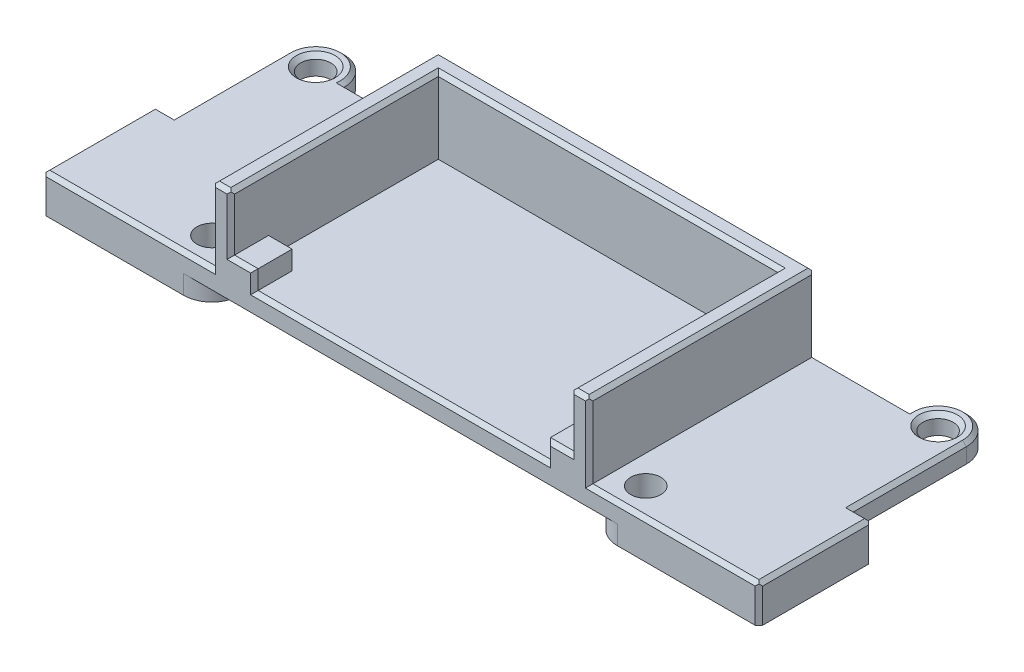
from build123d import *

# Parameters (mm, degrees)
SKETCH_1_W                   = 3
SKETCH_1_H                   = 1
SKETCH_1_H_2                 = 2
SKETCH_1_W_2                 = 30
EXTRUDE_1_DEPTH              = 1
SKETCH_2_W                   = 20
SKETCH_2_H                   = 12
SKETCH_2_W_2                 = 18
SKETCH_2_H_2                 = 10
EXTRUDE_4_DEPTH              = 4
SKETCH_8_W                   = 18
SKETCH_8_H                   = 4
CUT_EXTRUDE_2_DEPTH          = 4
SKETCH_9_W                   = 1.25
SKETCH_9_H                   = 1
EXTRUDE_5_DEPTH              = 2
EXTRUDE_6_DEPTH              = 1
HOLE_WIZARD_M2_1_D           = 1.6
HOLE_WIZARD_M2_1_DEPTH       = 5.5
HOLE_WIZARD_M2_1_CSINK_D     = 2.05
HOLE_WIZARD_M2_1_CSINK_ANGLE = 90
HOLE_WIZARD_M2_1_TIP         = 0.480688495
HOLE_WIZARD_M2_2_D           = 1.6
HOLE_WIZARD_M2_2_CSINK_D     = 2.05
HOLE_WIZARD_M2_2_CSINK_ANGLE = 90
CHAMFER_1_SIZE               = 0.2
CHAMFER_2_SIZE               = 0.2
CHAMFER_3_SIZE               = 0.2
CHAMFER_4_SIZE               = 0.2
CHAMFER_5_SIZE               = 0.2
SKETCH_16_R                  = 0.8
EXTRUDE_7_DEPTH              = 3
SKETCH_17_R                  = 0.8
CUT_EXTRUDE_3_DEPTH          = 22


with BuildPart() as part:
    # 草图1 → 凸台-拉伸1 (new body)
    with BuildSketch(Plane(origin=(0, 0, 0), x_dir=(1, 0, 0), z_dir=(0, 1, 0))):
        with BuildLine():
            ThreePointArc((-15, 4), (-16.5, 5.5), (-18, 4))
            Line((-18, 4), (-15, 4))
        make_face()
        with BuildLine():
            ThreePointArc((-15, 4), (-16.5, 2.5), (-18, 4))
            Line((-18, 4), (-18, -1))
            Line((-18, -1), (-15, -1))
            Line((-15, -1), (-15, -2))
            Line((-15, -2), (15, -2))
            Line((15, -2), (15, -1))
            Line((15, -1), (18, -1))
            Line((18, -1), (18, 4))
            ThreePointArc((18, 4), (16.5, 2.5), (15, 4))
            Line((15, 4), (-15, 4))
        make_face()
        with BuildLine():
            Line((-15, 4), (-18, 4))
            ThreePointArc((-18, 4), (-16.5, 2.5), (-15, 4))
        make_face()
        with Locations((-16.5, -1.5)):
            Rectangle(SKETCH_1_W, SKETCH_1_H)
        with BuildLine():
            ThreePointArc((18, 4), (16.5, 5.5), (15, 4))
            Line((15, 4), (18, 4))
        make_face()
        with BuildLine():
            Line((18, 4), (15, 4))
            ThreePointArc((15, 4), (16.5, 2.5), (18, 4))
        make_face()
        with Locations((-16.5, -3)):
            Rectangle(SKETCH_1_W, SKETCH_1_H_2)
        Polygon((-18, -4), (-18, -2), (-19, -2), (-19, -8), (19, -8), (19, -2), (18, -2), (18, -4), (15, -4), (-15, -4), align=None)
        with Locations((0, -3)):
            Rectangle(SKETCH_1_W_2, SKETCH_1_H_2)
        with Locations((16.5, -1.5)):
            Rectangle(SKETCH_1_W, SKETCH_1_H)
        with Locations((16.5, -3)):
            Rectangle(SKETCH_1_W, SKETCH_1_H_2)
    extrude(amount=EXTRUDE_1_DEPTH)

    # 草图2 → 凸台-拉伸4 (add)
    with BuildSketch(Plane(origin=(0, 1, 0), x_dir=(1, 0, 0), z_dir=(0, 1, 0))):
        with Locations((0, -2)):
            Rectangle(SKETCH_2_W, SKETCH_2_H)
        with Locations((0, -2)):
            Rectangle(SKETCH_2_W_2, SKETCH_2_H_2, mode=Mode.SUBTRACT)
    extrude(amount=EXTRUDE_4_DEPTH)

    # 草图8 → 切除-拉伸2 (cut)
    with BuildSketch(Plane.XY.offset(8)):
        with Locations((0, 3)):
            Rectangle(SKETCH_8_W, SKETCH_8_H)
    extrude(amount=-CUT_EXTRUDE_2_DEPTH, mode=Mode.SUBTRACT)

    # 草图9 → 凸台-拉伸5 (add)
    with BuildSketch(Plane.XY.offset(8)):
        with Locations((-8.375, 1.5)):
            Rectangle(SKETCH_9_W, SKETCH_9_H)
        with Locations((8.375, 1.5)):
            Rectangle(SKETCH_9_W, SKETCH_9_H)
    extrude(amount=-EXTRUDE_5_DEPTH)

    # 草图10 → 凸台-拉伸6 (add)
    with BuildSketch(Plane.XZ):
        Polygon((-13, 8), (-19, 8), (-19, 2), (-18, 2), (-13, 2), (-13, 5), (-13, 6.5), align=None)
        with BuildLine():
            ThreePointArc((-11.5, 5), (-12.560660172, 5.439339828), (-13, 6.5))
            Line((-13, 6.5), (-13, 5))
            Line((-13, 5), (-11.5, 5))
        make_face()
        with BuildLine():
            ThreePointArc((-11.5, 8), (-12.560660172, 7.560660172), (-13, 6.5))
            ThreePointArc((-13, 6.5), (-12.560660172, 5.439339828), (-11.5, 5))
            Line((-11.5, 5), (-11.5, 8))
        make_face()
        with BuildLine():
            ThreePointArc((-10, 6.5), (-10.439339828, 7.560660172), (-11.5, 8))
            Line((-11.5, 8), (-11.5, 5))
            ThreePointArc((-11.5, 5), (-10.439339828, 5.439339828), (-10, 6.5))
        make_face()
        with BuildLine():
            Line((-11.5, 8), (-13, 8))
            Line((-13, 8), (-13, 6.5))
            ThreePointArc((-13, 6.5), (-12.560660172, 7.560660172), (-11.5, 8))
        make_face()
        with BuildLine():
            ThreePointArc((13, 6.5), (12.560660172, 7.560660172), (11.5, 8))
            Line((11.5, 8), (11.5, 5))
            ThreePointArc((11.5, 5), (12.560660172, 5.439339828), (13, 6.5))
        make_face()
        with BuildLine():
            Line((11.5, 5), (11.5, 8))
            ThreePointArc((11.5, 8), (10, 6.5), (11.5, 5))
        make_face()
        with BuildLine():
            Line((13, 8), (11.5, 8))
            ThreePointArc((11.5, 8), (12.560660172, 7.560660172), (13, 6.5))
            Line((13, 6.5), (13, 8))
        make_face()
        with BuildLine():
            ThreePointArc((13, 6.5), (12.560660172, 5.439339828), (11.5, 5))
            Line((11.5, 5), (13, 5))
            Line((13, 5), (13, 6.5))
        make_face()
        Polygon((19, 8), (13, 8), (13, 6.5), (13, 5), (13, 2), (18, 2), (19, 2), align=None)
    extrude(amount=EXTRUDE_6_DEPTH)

    # M2 螺纹孔1
    with Locations(Plane(origin=(0, 1, 0), x_dir=(1, 0, 0), z_dir=(0, 1, 0))):
        with Locations((-16.5, 4), (16.5, 4)):
            CounterSinkHole(HOLE_WIZARD_M2_1_D / 2, HOLE_WIZARD_M2_1_CSINK_D / 2, depth=HOLE_WIZARD_M2_1_DEPTH, counter_sink_angle=HOLE_WIZARD_M2_1_CSINK_ANGLE)
            with Locations((0, 0, -(HOLE_WIZARD_M2_1_DEPTH + HOLE_WIZARD_M2_1_TIP / 2))):  # 118° drill point
                Cone(0, HOLE_WIZARD_M2_1_D / 2, HOLE_WIZARD_M2_1_TIP, mode=Mode.SUBTRACT)

    # M2 螺纹孔2 (through all)
    with Locations(Plane(origin=(0, -1, 0), x_dir=(-1, 0, 0), z_dir=(0, -1, 0))):
        with Locations((11.5, -6.5), (-11.5, -6.5)):
            CounterSinkHole(HOLE_WIZARD_M2_2_D / 2, HOLE_WIZARD_M2_2_CSINK_D / 2, counter_sink_angle=HOLE_WIZARD_M2_2_CSINK_ANGLE)

    # 倒角1
    chamfer_1_edges = [part.edges().sort_by_distance(p)[0] for p in [
        (-10, 5, 2),
        (-9.5, 5, 8),
        (10, 5, 2),
        (0, 5, -4),
        (0, 5, -3),
        (-9, 5, 2.5),
        (9, 5, 2.5),
        (9.5, 5, 8),
    ]]
    chamfer(chamfer_1_edges, length=CHAMFER_1_SIZE)

    # 倒角2
    chamfer_2_edges = [part.edges().sort_by_distance(p)[0] for p in [
        (-18, 1, -1),
        (-18.5, 1, 2),
        (-19, 1, 5),
        (-14.5, 1, 8),
        (19, 1, 5),
        (18.5, 1, 2),
        (12.5, 1, -4),
        (14.5, 1, 8),
        (18, 1, -1),
        (-12.5, 1, -4),
        (16.5, 1, -5.5),
        (-16.5, 1, -5.5),
    ]]
    chamfer(chamfer_2_edges, length=CHAMFER_2_SIZE)

    # 倒角3
    chamfer_3_edges = [part.edges().sort_by_distance(p)[0] for p in [
        (7.75, 1.5, 8),
        (-9, 3.4, 8),
        (-10, 2.8, 8),
        (10, 2.8, 8),
        (0, 1, 8),
        (-7.75, 1.5, 8),
        (-8.375, 2, 8),
        (9, 3.4, 8),
        (8.375, 2, 8),
    ]]
    chamfer(chamfer_3_edges, length=CHAMFER_3_SIZE)

    # 倒角4
    chamfer_4_edges = [part.edges().sort_by_distance(p)[0] for p in [
        (-19, -0.1, 8),
        (19, -0.1, 8),
        (-19, -0.1, 2),
        (19, -0.1, 2),
    ]]
    chamfer(chamfer_4_edges, length=CHAMFER_4_SIZE)

    # 倒角5
    chamfer_5_edges = [part.edges().sort_by_distance(p)[0] for p in [
        (-10, 2.8, -4),
        (10, 2.8, -4),
    ]]
    chamfer(chamfer_5_edges, length=CHAMFER_5_SIZE)

    # 草图16 → 凸台-拉伸7 (add)
    with BuildSketch(Plane(origin=(0, 1, 0), x_dir=(1, 0, 0), z_dir=(0, 1, 0))):
        with Locations(Location((16.5, 4, 0), (0, 0, 270))):
            Circle(SKETCH_16_R)
        with Locations(Location((11.5, -6.5, 0), (0, 0, 270))):
            Circle(SKETCH_16_R)
        with Locations(Location((-11.5, -6.5, 0), (0, 0, 270))):
            Circle(SKETCH_16_R)
        with Locations(Location((-16.5, 4, 0), (0, 0, 270))):
            Circle(SKETCH_16_R)
    extrude(amount=-EXTRUDE_7_DEPTH)

    # 草图17 → 切除-拉伸3 (cut, through all)
    with BuildSketch(Plane(origin=(0, 1, 0), x_dir=(1, 0, 0), z_dir=(0, 1, 0))):
        with Locations(Location((-16.5, 4, 0), (0, 0, 270))):
            Circle(SKETCH_17_R)
        with Locations(Location((-11.5, -6.5, 0), (0, 0, 270))):
            Circle(SKETCH_17_R)
        with Locations(Location((11.5, -6.5, 0), (0, 0, 270))):
            Circle(SKETCH_17_R)
        with Locations(Location((16.5, 4, 0), (0, 0, 270))):
            Circle(SKETCH_17_R)
    extrude(amount=-CUT_EXTRUDE_3_DEPTH, mode=Mode.SUBTRACT)


solid = part.part
